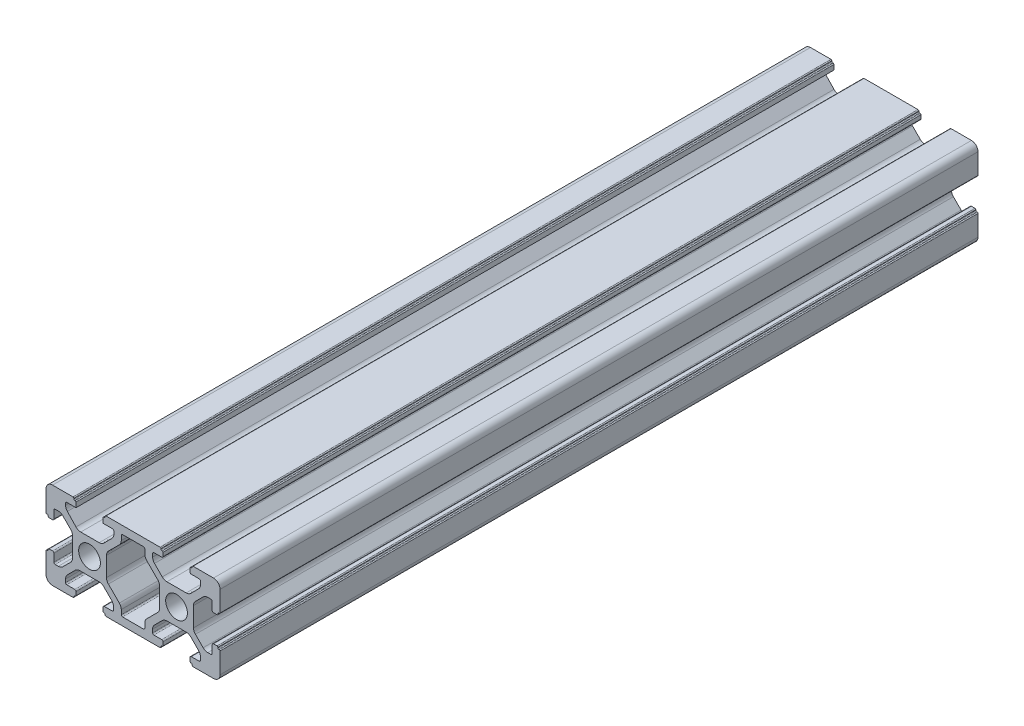
from build123d import *

# Parameters (mm, degrees)
SKETCH1_R           = 2.5
BOSS_EXTRUDE2_DEPTH = 174.2


with BuildPart() as part:
    # Sketch1 → Boss-Extrude2 (new body)
    with BuildSketch(Plane.XY):
        with BuildLine():
            Line((1.5, 0), (6.2, 0))
            ThreePointArc((6.2, 0), (6.341421356, 0.058578644), (6.4, 0.2))
            Line((6.4, 0.2), (6.4, 0.3))
            ThreePointArc((6.4, 0.3), (6.458578644, 0.441421356), (6.6, 0.5))
            Line((6.6, 0.5), (6.7, 0.5))
            ThreePointArc((6.7, 0.5), (6.841421356, 0.558578644), (6.9, 0.7))
            Line((6.9, 0.7), (6.9, 1.5))
            ThreePointArc((6.9, 1.5), (6.812132034, 1.712132034), (6.6, 1.8))
            Line((6.6, 1.8), (4.8, 1.8))
            ThreePointArc((4.8, 1.8), (4.587867966, 1.887867966), (4.5, 2.1))
            Line((4.5, 2.1), (4.5, 2.818019485))
            ThreePointArc((4.5, 2.818019485), (4.614180701, 3.392044633), (4.939339828, 3.878679656))
            Line((4.939339828, 3.878679656), (6.721320344, 5.660660172))
            ThreePointArc((6.721320344, 5.660660172), (7.207955367, 5.985819299), (7.781980515, 6.1))
            Line((7.781980515, 6.1), (12.218019485, 6.1))
            ThreePointArc((12.218019485, 6.1), (12.792044633, 5.985819299), (13.278679656, 5.660660172))
            Line((13.278679656, 5.660660172), (15.060660172, 3.878679656))
            ThreePointArc((15.060660172, 3.878679656), (15.385819299, 3.392044633), (15.5, 2.818019485))
            Line((15.5, 2.818019485), (15.5, 2.1))
            ThreePointArc((15.5, 2.1), (15.412132034, 1.887867966), (15.2, 1.8))
            Line((15.2, 1.8), (13.4, 1.8))
            ThreePointArc((13.4, 1.8), (13.187867966, 1.712132034), (13.1, 1.5))
            Line((13.1, 1.5), (13.1, 0.7))
            ThreePointArc((13.1, 0.7), (13.158578644, 0.558578644), (13.3, 0.5))
            Line((13.3, 0.5), (13.4, 0.5))
            ThreePointArc((13.4, 0.5), (13.541421356, 0.441421356), (13.6, 0.3))
            Line((13.6, 0.3), (13.6, 0.2))
            ThreePointArc((13.6, 0.2), (13.658578644, 0.058578644), (13.8, 0))
            Line((13.8, 0), (26.2, 0))
            ThreePointArc((26.2, 0), (26.341421356, 0.058578644), (26.4, 0.2))
            Line((26.4, 0.2), (26.4, 0.3))
            ThreePointArc((26.4, 0.3), (26.458578644, 0.441421356), (26.6, 0.5))
            Line((26.6, 0.5), (26.7, 0.5))
            ThreePointArc((26.7, 0.5), (26.841421356, 0.558578644), (26.9, 0.7))
            Line((26.9, 0.7), (26.9, 1.5))
            ThreePointArc((26.9, 1.5), (26.812132034, 1.712132034), (26.6, 1.8))
            Line((26.6, 1.8), (24.8, 1.8))
            ThreePointArc((24.8, 1.8), (24.587867966, 1.887867966), (24.5, 2.1))
            Line((24.5, 2.1), (24.5, 2.818019485))
            ThreePointArc((24.5, 2.818019485), (24.614180701, 3.392044633), (24.939339828, 3.878679656))
            Line((24.939339828, 3.878679656), (26.721320344, 5.660660172))
            ThreePointArc((26.721320344, 5.660660172), (27.207955367, 5.985819299), (27.781980515, 6.1))
            Line((27.781980515, 6.1), (32.218019485, 6.1))
            ThreePointArc((32.218019485, 6.1), (32.792044633, 5.985819299), (33.278679656, 5.660660172))
            Line((33.278679656, 5.660660172), (35.060660172, 3.878679656))
            ThreePointArc((35.060660172, 3.878679656), (35.385819299, 3.392044633), (35.5, 2.818019485))
            Line((35.5, 2.818019485), (35.5, 2.1))
            ThreePointArc((35.5, 2.1), (35.412132034, 1.887867966), (35.2, 1.8))
            Line((35.2, 1.8), (33.4, 1.8))
            ThreePointArc((33.4, 1.8), (33.187867966, 1.712132034), (33.1, 1.5))
            Line((33.1, 1.5), (33.1, 0.7))
            ThreePointArc((33.1, 0.7), (33.158578644, 0.558578644), (33.3, 0.5))
            Line((33.3, 0.5), (33.4, 0.5))
            ThreePointArc((33.4, 0.5), (33.541421356, 0.441421356), (33.6, 0.3))
            Line((33.6, 0.3), (33.6, 0.2))
            ThreePointArc((33.6, 0.2), (33.658578644, 0.058578644), (33.8, 0))
            Line((33.8, 0), (38.5, 0))
            ThreePointArc((38.5, 0), (39.560660172, 0.439339828), (40, 1.5))
            Line((40, 1.5), (40, 6.2))
            ThreePointArc((40, 6.2), (39.941421356, 6.341421356), (39.8, 6.4))
            Line((39.8, 6.4), (39.7, 6.4))
            ThreePointArc((39.7, 6.4), (39.558578644, 6.458578644), (39.5, 6.6))
            Line((39.5, 6.6), (39.5, 6.7))
            ThreePointArc((39.5, 6.7), (39.441421356, 6.841421356), (39.3, 6.9))
            Line((39.3, 6.9), (38.5, 6.9))
            ThreePointArc((38.5, 6.9), (38.287867966, 6.812132034), (38.2, 6.6))
            Line((38.2, 6.6), (38.2, 4.8))
            ThreePointArc((38.2, 4.8), (38.112132034, 4.587867966), (37.9, 4.5))
            Line((37.9, 4.5), (37.181980515, 4.5))
            ThreePointArc((37.181980515, 4.5), (36.607955367, 4.614180701), (36.121320344, 4.939339828))
            Line((36.121320344, 4.939339828), (34.339339828, 6.721320344))
            ThreePointArc((34.339339828, 6.721320344), (34.014180701, 7.207955367), (33.9, 7.781980515))
            Line((33.9, 7.781980515), (33.9, 12.218019485))
            ThreePointArc((33.9, 12.218019485), (34.014180701, 12.792044633), (34.339339828, 13.278679656))
            Line((34.339339828, 13.278679656), (36.121320344, 15.060660172))
            ThreePointArc((36.121320344, 15.060660172), (36.607955367, 15.385819299), (37.181980515, 15.5))
            Line((37.181980515, 15.5), (37.9, 15.5))
            ThreePointArc((37.9, 15.5), (38.112132034, 15.412132034), (38.2, 15.2))
            Line((38.2, 15.2), (38.2, 13.4))
            ThreePointArc((38.2, 13.4), (38.287867966, 13.187867966), (38.5, 13.1))
            Line((38.5, 13.1), (39.3, 13.1))
            ThreePointArc((39.3, 13.1), (39.441421356, 13.158578644), (39.5, 13.3))
            Line((39.5, 13.3), (39.5, 13.4))
            ThreePointArc((39.5, 13.4), (39.558578644, 13.541421356), (39.7, 13.6))
            Line((39.7, 13.6), (39.8, 13.6))
            ThreePointArc((39.8, 13.6), (39.941421356, 13.658578644), (40, 13.8))
            Line((40, 13.8), (40, 18.5))
            ThreePointArc((40, 18.5), (39.560660172, 19.560660172), (38.5, 20))
            Line((38.5, 20), (33.8, 20))
            ThreePointArc((33.8, 20), (33.658578644, 19.941421356), (33.6, 19.8))
            Line((33.6, 19.8), (33.6, 19.7))
            ThreePointArc((33.6, 19.7), (33.541421356, 19.558578644), (33.4, 19.5))
            Line((33.4, 19.5), (33.3, 19.5))
            ThreePointArc((33.3, 19.5), (33.158578644, 19.441421356), (33.1, 19.3))
            Line((33.1, 19.3), (33.1, 18.5))
            ThreePointArc((33.1, 18.5), (33.187867966, 18.287867966), (33.4, 18.2))
            Line((33.4, 18.2), (35.2, 18.2))
            ThreePointArc((35.2, 18.2), (35.412132034, 18.112132034), (35.5, 17.9))
            Line((35.5, 17.9), (35.5, 17.181980515))
            ThreePointArc((35.5, 17.181980515), (35.385819299, 16.607955367), (35.060660172, 16.121320344))
            Line((35.060660172, 16.121320344), (33.278679656, 14.339339828))
            ThreePointArc((33.278679656, 14.339339828), (32.792044633, 14.014180701), (32.218019485, 13.9))
            Line((32.218019485, 13.9), (27.781980515, 13.9))
            ThreePointArc((27.781980515, 13.9), (27.207955367, 14.014180701), (26.721320344, 14.339339828))
            Line((26.721320344, 14.339339828), (24.939339828, 16.121320344))
            ThreePointArc((24.939339828, 16.121320344), (24.614180701, 16.607955367), (24.5, 17.181980515))
            Line((24.5, 17.181980515), (24.5, 17.9))
            ThreePointArc((24.5, 17.9), (24.587867966, 18.112132034), (24.8, 18.2))
            Line((24.8, 18.2), (26.6, 18.2))
            ThreePointArc((26.6, 18.2), (26.812132034, 18.287867966), (26.9, 18.5))
            Line((26.9, 18.5), (26.9, 19.3))
            ThreePointArc((26.9, 19.3), (26.841421356, 19.441421356), (26.7, 19.5))
            Line((26.7, 19.5), (26.6, 19.5))
            ThreePointArc((26.6, 19.5), (26.458578644, 19.558578644), (26.4, 19.7))
            Line((26.4, 19.7), (26.4, 19.8))
            ThreePointArc((26.4, 19.8), (26.341421356, 19.941421356), (26.2, 20))
            Line((26.2, 20), (13.8, 20))
            ThreePointArc((13.8, 20), (13.658578644, 19.941421356), (13.6, 19.8))
            Line((13.6, 19.8), (13.6, 19.7))
            ThreePointArc((13.6, 19.7), (13.541421356, 19.558578644), (13.4, 19.5))
            Line((13.4, 19.5), (13.3, 19.5))
            ThreePointArc((13.3, 19.5), (13.158578644, 19.441421356), (13.1, 19.3))
            Line((13.1, 19.3), (13.1, 18.2))
            Line((13.1, 18.2), (15.3, 18.2))
            ThreePointArc((15.3, 18.2), (15.512132034, 18.112132034), (15.6, 17.9))
            Line((15.6, 17.9), (15.6, 17.281980515))
            ThreePointArc((15.6, 17.281980515), (15.485819299, 16.707955367), (15.160660172, 16.221320344))
            Line((15.160660172, 16.221320344), (13.278679656, 14.339339828))
            ThreePointArc((13.278679656, 14.339339828), (12.792044633, 14.014180701), (12.218019485, 13.9))
            Line((12.218019485, 13.9), (7.986375635, 13.9))
            ThreePointArc((7.986375635, 13.9), (7.393381044, 14.022191082), (6.896997987, 14.36885678))
            Line((6.896997987, 14.36885678), (4.910622352, 16.467414163))
            ThreePointArc((4.910622352, 16.467414163), (4.606431474, 16.943609851), (4.5, 17.498557383))
            Line((4.5, 17.498557383), (4.5, 17.9))
            ThreePointArc((4.5, 17.9), (4.587867966, 18.112132034), (4.8, 18.2))
            Line((4.8, 18.2), (6.9, 18.2))
            Line((6.9, 18.2), (6.9, 19.3))
            ThreePointArc((6.9, 19.3), (6.841421356, 19.441421356), (6.7, 19.5))
            Line((6.7, 19.5), (6.6, 19.5))
            ThreePointArc((6.6, 19.5), (6.458578644, 19.558578644), (6.4, 19.7))
            Line((6.4, 19.7), (6.4, 19.8))
            ThreePointArc((6.4, 19.8), (6.341421356, 19.941421356), (6.2, 20))
            Line((6.2, 20), (1.5, 20))
            ThreePointArc((1.5, 20), (0.439339828, 19.560660172), (0, 18.5))
            Line((0, 18.5), (0, 13.8))
            ThreePointArc((0, 13.8), (0.058578644, 13.658578644), (0.2, 13.6))
            Line((0.2, 13.6), (0.3, 13.6))
            ThreePointArc((0.3, 13.6), (0.441421356, 13.541421356), (0.5, 13.4))
            Line((0.5, 13.4), (0.5, 13.3))
            ThreePointArc((0.5, 13.3), (0.558578644, 13.158578644), (0.7, 13.1))
            Line((0.7, 13.1), (1.5, 13.1))
            ThreePointArc((1.5, 13.1), (1.712132034, 13.187867966), (1.8, 13.4))
            Line((1.8, 13.4), (1.8, 15.2))
            ThreePointArc((1.8, 15.2), (1.887867966, 15.412132034), (2.1, 15.5))
            Line((2.1, 15.5), (2.818019485, 15.5))
            ThreePointArc((2.818019485, 15.5), (3.392044633, 15.385819299), (3.878679656, 15.060660172))
            Line((3.878679656, 15.060660172), (5.660660172, 13.278679656))
            ThreePointArc((5.660660172, 13.278679656), (5.985819299, 12.792044633), (6.1, 12.218019485))
            Line((6.1, 12.218019485), (6.1, 7.781980515))
            ThreePointArc((6.1, 7.781980515), (5.985819299, 7.207955367), (5.660660172, 6.721320344))
            Line((5.660660172, 6.721320344), (3.878679656, 4.939339828))
            ThreePointArc((3.878679656, 4.939339828), (3.392044633, 4.614180701), (2.818019485, 4.5))
            Line((2.818019485, 4.5), (2.1, 4.5))
            ThreePointArc((2.1, 4.5), (1.887867966, 4.587867966), (1.8, 4.8))
            Line((1.8, 4.8), (1.8, 6.6))
            ThreePointArc((1.8, 6.6), (1.712132034, 6.812132034), (1.5, 6.9))
            Line((1.5, 6.9), (0.7, 6.9))
            ThreePointArc((0.7, 6.9), (0.558578644, 6.841421356), (0.5, 6.7))
            Line((0.5, 6.7), (0.5, 6.6))
            ThreePointArc((0.5, 6.6), (0.441421356, 6.458578644), (0.3, 6.4))
            Line((0.3, 6.4), (0.2, 6.4))
            ThreePointArc((0.2, 6.4), (0.058578644, 6.341421356), (0, 6.2))
            Line((0, 6.2), (0, 1.5))
            ThreePointArc((0, 1.5), (0.439339828, 0.439339828), (1.5, 0))
        make_face()
        with Locations((10, 10)):
            Circle(SKETCH1_R, mode=Mode.SUBTRACT)
        with Locations((30, 10)):
            Circle(SKETCH1_R, mode=Mode.SUBTRACT)
        with BuildLine():
            Line((17.6, 1.8), (22.4, 1.8))
            ThreePointArc((22.4, 1.8), (22.612132034, 1.887867966), (22.7, 2.1))
            Line((22.7, 2.1), (22.7, 3.139339828))
            ThreePointArc((22.7, 3.139339828), (22.814180701, 3.713364977), (23.139339828, 4.2))
            Line((23.139339828, 4.2), (25.660660172, 6.721320344))
            ThreePointArc((25.660660172, 6.721320344), (25.985819299, 7.207955367), (26.1, 7.781980515))
            Line((26.1, 7.781980515), (26.1, 12.218019485))
            ThreePointArc((26.1, 12.218019485), (25.985819299, 12.792044633), (25.660660172, 13.278679656))
            Line((25.660660172, 13.278679656), (23.139339828, 15.8))
            ThreePointArc((23.139339828, 15.8), (22.814180701, 16.286635023), (22.7, 16.860660172))
            Line((22.7, 16.860660172), (22.7, 17.9))
            ThreePointArc((22.7, 17.9), (22.612132034, 18.112132034), (22.4, 18.2))
            Line((22.4, 18.2), (17.6, 18.2))
            ThreePointArc((17.6, 18.2), (17.387867966, 18.112132034), (17.3, 17.9))
            Line((17.3, 17.9), (17.3, 16.860660172))
            ThreePointArc((17.3, 16.860660172), (17.185819299, 16.286635023), (16.860660172, 15.8))
            Line((16.860660172, 15.8), (14.339339828, 13.278679656))
            ThreePointArc((14.339339828, 13.278679656), (14.014180701, 12.792044633), (13.9, 12.218019485))
            Line((13.9, 12.218019485), (13.9, 7.781980515))
            ThreePointArc((13.9, 7.781980515), (14.014180701, 7.207955367), (14.339339828, 6.721320344))
            Line((14.339339828, 6.721320344), (16.860660172, 4.2))
            ThreePointArc((16.860660172, 4.2), (17.185819299, 3.713364977), (17.3, 3.139339828))
            Line((17.3, 3.139339828), (17.3, 2.1))
            ThreePointArc((17.3, 2.1), (17.387867966, 1.887867966), (17.6, 1.8))
        make_face(mode=Mode.SUBTRACT)
    extrude(amount=BOSS_EXTRUDE2_DEPTH)


solid = part.part
